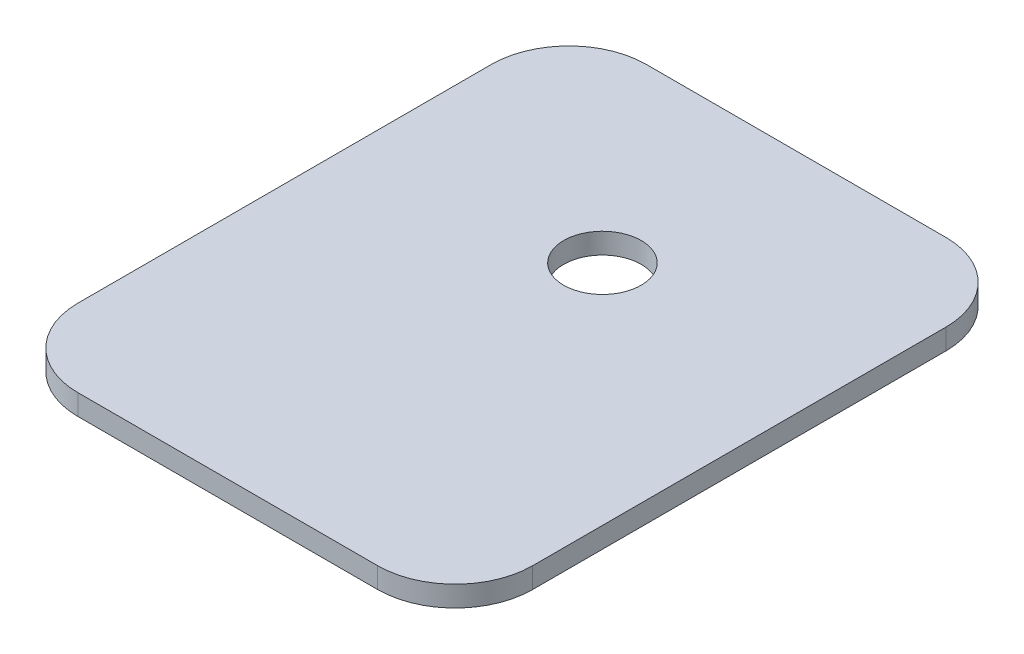
from build123d import *

# Parameters (mm, degrees)
SKETCH1_W           = 35.2
SKETCH1_H           = 44
BOSS_EXTRUDE1_DEPTH = 1.6
FILLET1_R           = 6
SKETCH2_R           = 3
CUT_EXTRUDE1_DEPTH  = 1.6


with BuildPart() as part:
    # Sketch1 → Boss-Extrude1 (new body)
    with BuildSketch(Plane(origin=(0, 0, 0), x_dir=(1, 0, 0), z_dir=(0, 1, 0))):
        Rectangle(SKETCH1_W, SKETCH1_H)
    extrude(amount=BOSS_EXTRUDE1_DEPTH)

    # Fillet1
    fillet1_edges = [part.edges().sort_by_distance(p)[0] for p in [
        (17.6, 0.8, 22),
        (-17.6, 0.8, 22),
        (-17.6, 0.8, -22),
        (17.6, 0.8, -22),
    ]]
    fillet(fillet1_edges, radius=FILLET1_R)

    # Sketch2 → Cut-Extrude1 (cut)
    with BuildSketch(Plane(origin=(0, 1.6, 0), x_dir=(1, 0, 0), z_dir=(0, 1, 0))):
        with Locations(Location((0, 7, 0), (0, 0, 270))):
            Circle(SKETCH2_R)
    extrude(amount=-CUT_EXTRUDE1_DEPTH, mode=Mode.SUBTRACT)


solid = part.part
